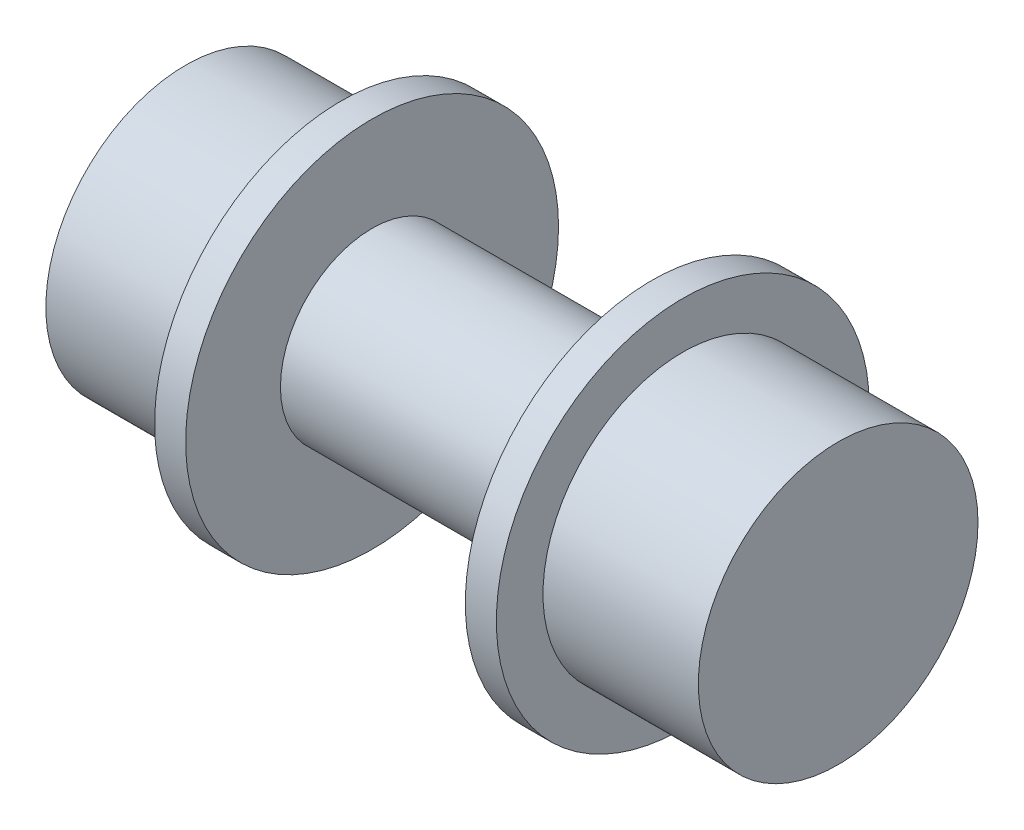
from build123d import *

# Parameters (mm, degrees)
SKETCH1_R           = 37.465
BOSS_EXTRUDE1_DEPTH = 57.15
BOSS_EXTRUDE2_START = 69.85
SKETCH1_3_R         = 76.2
SKETCH1_3_R_2       = 57.15
SKETCH1_3_R_3       = 37.465
BOSS_EXTRUDE2_DEPTH = 12.7
BOSS_EXTRUDE3_START = 133.35
SKETCH1_4_R         = 57.15
SKETCH1_4_R_2       = 37.465
BOSS_EXTRUDE3_DEPTH = 63.5
BOSS_EXTRUDE4_START = -57.15
SKETCH1_5_R         = 76.2
SKETCH1_5_R_2       = 57.15
SKETCH1_5_R_3       = 37.465
BOSS_EXTRUDE4_DEPTH = 12.7
BOSS_EXTRUDE5_START = -69.85
SKETCH1_6_R         = 57.15
SKETCH1_6_R_2       = 37.465
BOSS_EXTRUDE5_DEPTH = 63.5


with BuildPart() as part:
    # Sketch1 → Boss-Extrude1 (new, symmetric)
    with BuildSketch(Plane(origin=(0, 0, 0), x_dir=(0, 0, -1), z_dir=(1, 0, 0))):
        Circle(SKETCH1_R)
    extrude(amount=BOSS_EXTRUDE1_DEPTH, both=True)

    # Sketch1<3> → Boss-Extrude2 (add)
    # profile 1 of 3: a face of its own
    with BuildSketch(Plane(origin=(0, 0, 0), x_dir=(0, 0, -1), z_dir=(1, 0, 0)).offset(BOSS_EXTRUDE2_START)):
        Circle(SKETCH1_3_R)
        Circle(SKETCH1_3_R_2, mode=Mode.SUBTRACT)
    # profile 2 of 3: a face of its own
    with BuildSketch(Plane(origin=(0, 0, 0), x_dir=(0, 0, -1), z_dir=(1, 0, 0)).offset(BOSS_EXTRUDE2_START)):
        Circle(SKETCH1_3_R_2)
        Circle(SKETCH1_3_R_3, mode=Mode.SUBTRACT)
    # profile 3 of 3: a face of its own
    with BuildSketch(Plane(origin=(0, 0, 0), x_dir=(0, 0, -1), z_dir=(1, 0, 0)).offset(BOSS_EXTRUDE2_START)):
        Circle(SKETCH1_3_R_3)
    extrude(amount=-BOSS_EXTRUDE2_DEPTH)

    # Sketch1<4> → Boss-Extrude3 (add)
    # profile 1 of 2: a face of its own
    with BuildSketch(Plane(origin=(0, 0, 0), x_dir=(0, 0, -1), z_dir=(1, 0, 0)).offset(BOSS_EXTRUDE3_START)):
        Circle(SKETCH1_4_R)
        Circle(SKETCH1_4_R_2, mode=Mode.SUBTRACT)
    # profile 2 of 2: a face of its own
    with BuildSketch(Plane(origin=(0, 0, 0), x_dir=(0, 0, -1), z_dir=(1, 0, 0)).offset(BOSS_EXTRUDE3_START)):
        Circle(SKETCH1_4_R_2)
    extrude(amount=-BOSS_EXTRUDE3_DEPTH)

    # Sketch1<5> → Boss-Extrude4 (add)
    # profile 1 of 3: a face of its own
    with BuildSketch(Plane(origin=(0, 0, 0), x_dir=(0, 0, -1), z_dir=(1, 0, 0)).offset(BOSS_EXTRUDE4_START)):
        Circle(SKETCH1_5_R)
        Circle(SKETCH1_5_R_2, mode=Mode.SUBTRACT)
    # profile 2 of 3: a face of its own
    with BuildSketch(Plane(origin=(0, 0, 0), x_dir=(0, 0, -1), z_dir=(1, 0, 0)).offset(BOSS_EXTRUDE4_START)):
        Circle(SKETCH1_5_R_2)
        Circle(SKETCH1_5_R_3, mode=Mode.SUBTRACT)
    # profile 3 of 3: a face of its own
    with BuildSketch(Plane(origin=(0, 0, 0), x_dir=(0, 0, -1), z_dir=(1, 0, 0)).offset(BOSS_EXTRUDE4_START)):
        Circle(SKETCH1_5_R_3)
    extrude(amount=-BOSS_EXTRUDE4_DEPTH)

    # Sketch1<6> → Boss-Extrude5 (add)
    # profile 1 of 2: a face of its own
    with BuildSketch(Plane(origin=(0, 0, 0), x_dir=(0, 0, -1), z_dir=(1, 0, 0)).offset(BOSS_EXTRUDE5_START)):
        Circle(SKETCH1_6_R)
        Circle(SKETCH1_6_R_2, mode=Mode.SUBTRACT)
    # profile 2 of 2: a face of its own
    with BuildSketch(Plane(origin=(0, 0, 0), x_dir=(0, 0, -1), z_dir=(1, 0, 0)).offset(BOSS_EXTRUDE5_START)):
        Circle(SKETCH1_6_R_2)
    extrude(amount=-BOSS_EXTRUDE5_DEPTH)


solid = part.part
